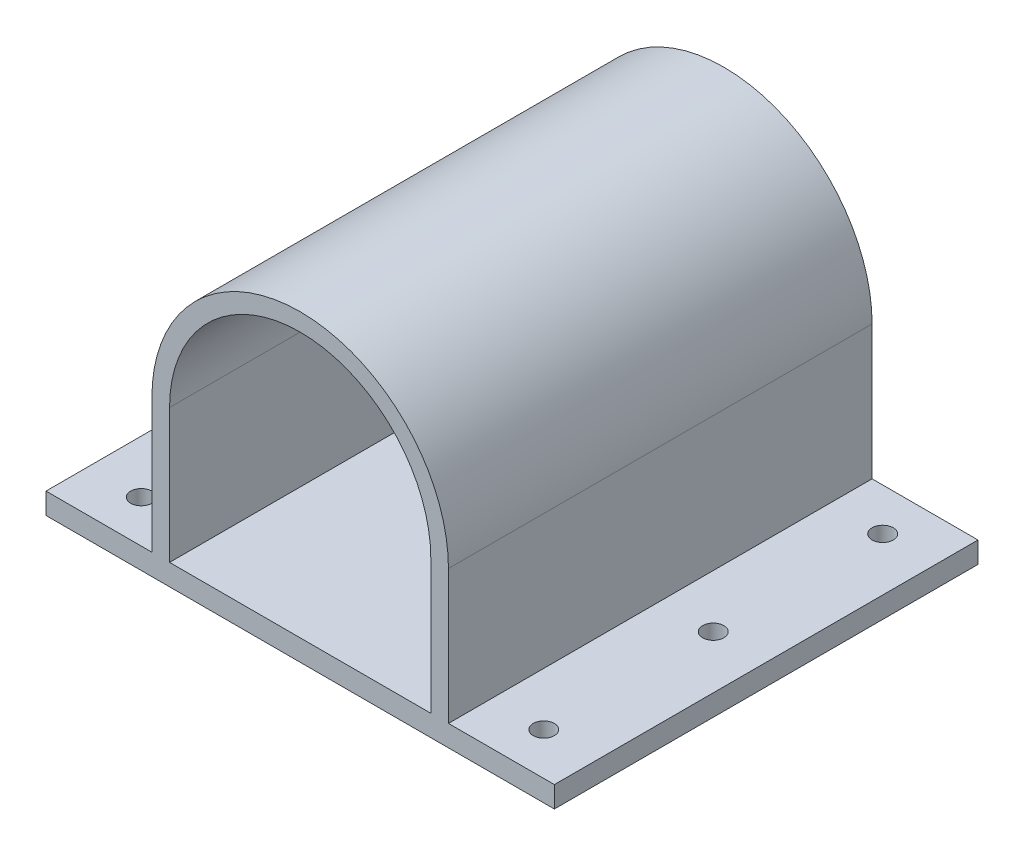
from build123d import *

# Parameters (mm, degrees)
SKETCH1_R           = 6.15
SKETCH1_R_2         = 1.65
BOSS_EXTRUDE1_DEPTH = 60
CUT_EXTRUDE1_DEPTH  = 57
SKETCH3_R           = 1.5
CUT_EXTRUDE2_DEPTH  = 81.597766718


with BuildPart() as part:
    # Sketch1 → Boss-Extrude1 (new body)
    with BuildSketch(Plane.XY):
        with BuildLine():
            Line((-21, 0), (-21, -19))
            Line((-21, -19), (-36, -19))
            Line((-36, -19), (-36, -22))
            Line((-36, -22), (36, -22))
            Line((36, -22), (36, -19))
            Line((36, -19), (21, -19))
            Line((21, -19), (21, 0))
            ThreePointArc((21, 0), (0, 21), (-21, 0))
        make_face()
        with Locations((0, -7)):
            Circle(SKETCH1_R, mode=Mode.SUBTRACT)
        with Locations((-15.5, 0)):
            Circle(SKETCH1_R_2, mode=Mode.SUBTRACT)
        with Locations((-7.75, 13.423393759)):
            Circle(SKETCH1_R_2, mode=Mode.SUBTRACT)
        with Locations((7.75, 13.423393759)):
            Circle(SKETCH1_R_2, mode=Mode.SUBTRACT)
        with Locations((15.5, 0)):
            Circle(SKETCH1_R_2, mode=Mode.SUBTRACT)
        with Locations((7.75, -13.423393759)):
            Circle(SKETCH1_R_2, mode=Mode.SUBTRACT)
        with Locations((-7.75, -13.423393759)):
            Circle(SKETCH1_R_2, mode=Mode.SUBTRACT)
    extrude(amount=BOSS_EXTRUDE1_DEPTH)

    # Sketch2 → Cut-Extrude1 (cut)
    with BuildSketch(Plane.XY.offset(60)):
        with BuildLine():
            Line((-18.5, 0), (-18.5, -19))
            Line((-18.5, -19), (18.5, -19))
            Line((18.5, -19), (18.5, 0))
            ThreePointArc((18.5, 0), (0, 18.5), (-18.5, 0))
        make_face()
    extrude(amount=-CUT_EXTRUDE1_DEPTH, mode=Mode.SUBTRACT)

    # Sketch3 → Cut-Extrude2 (cut, through all)
    with BuildSketch(Plane(origin=(0, -19, 0), x_dir=(1, 0, 0), z_dir=(0, 1, 0))):
        with Locations(Location((-28.5, -30, 0), (0, 0, 270))):
            Circle(SKETCH3_R)
        with Locations(Location((-28.5, -6, 0), (0, 0, 270))):
            Circle(SKETCH3_R)
        with Locations(Location((-28.5, -54, 0), (0, 0, 270))):
            Circle(SKETCH3_R)
        with Locations(Location((28.5, -54, 0), (0, 0, 90))):
            Circle(SKETCH3_R)
        with Locations(Location((28.5, -6, 0), (0, 0, 90))):
            Circle(SKETCH3_R)
        with Locations(Location((28.5, -30, 0), (0, 0, 90))):
            Circle(SKETCH3_R)
    extrude(amount=-CUT_EXTRUDE2_DEPTH, mode=Mode.SUBTRACT)


solid = part.part
